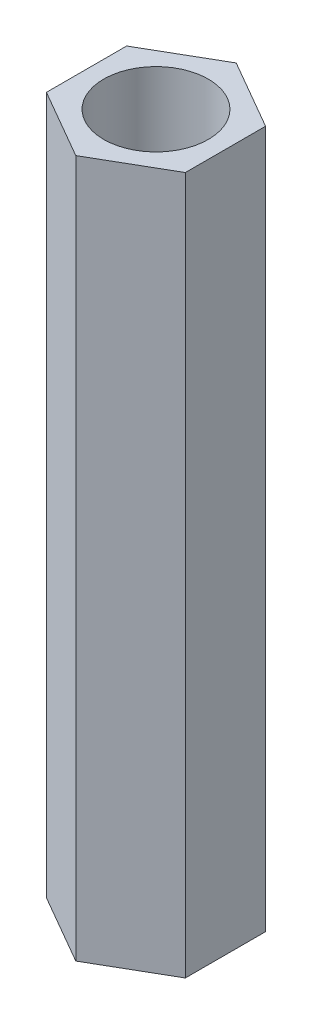
from build123d import *

# Parameters (mm, degrees)
SKETCH_1_R      = 1.5
EXTRUDE_1_DEPTH = 20


with BuildPart() as part:
    # 草图1 → 凸台-拉伸1 (new body)
    with BuildSketch(Plane(origin=(0, 0, 0), x_dir=(1, 0, 0), z_dir=(0, 1, 0))):
        Polygon((1.991858429, 1.15), (0, 2.3), (-1.991858429, 1.15), (-1.991858429, -1.15), (0, -2.3), (1.991858429, -1.15), align=None)
        with Locations(Location((0, 0, 0), (0, 0, 270))):
            Circle(SKETCH_1_R, mode=Mode.SUBTRACT)
    extrude(amount=EXTRUDE_1_DEPTH)


solid = part.part
